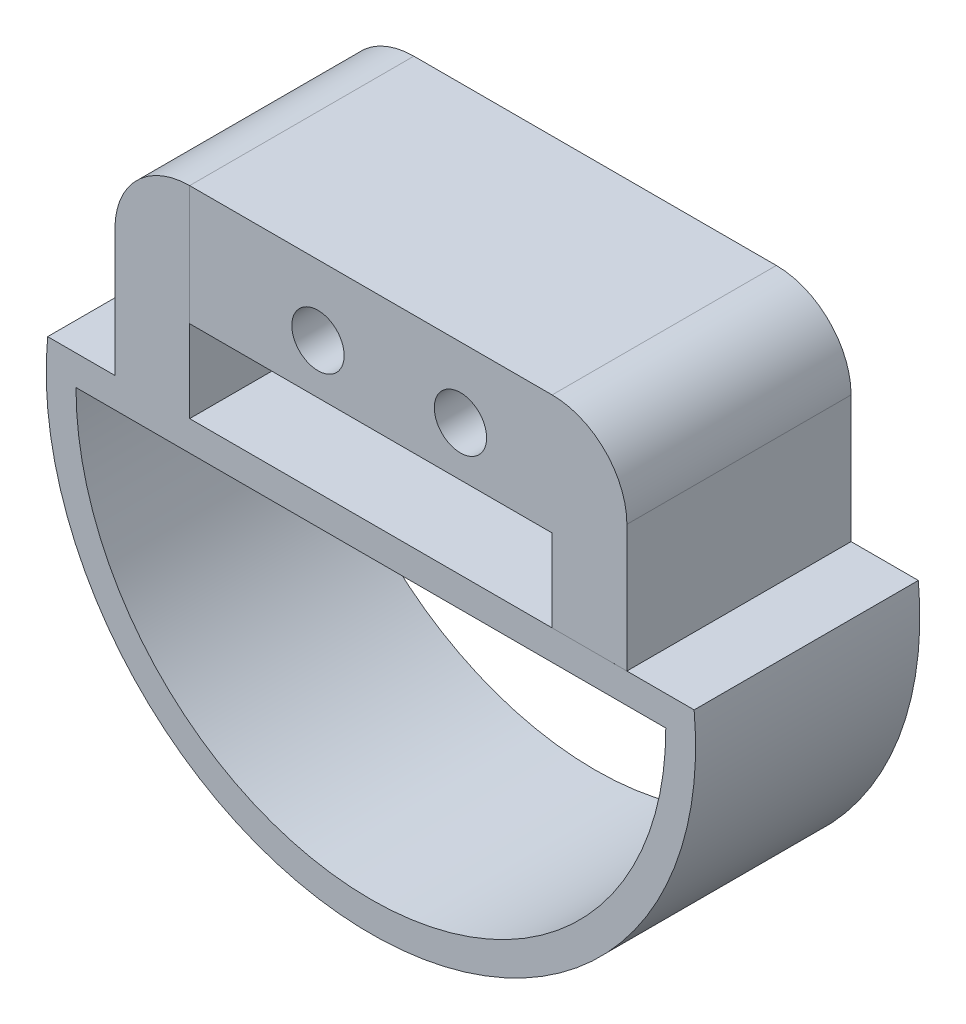
from build123d import *

# Parameters (mm, degrees)
BOSS_EXTRUDE3_DEPTH      = 15
BOSS_EXTRUDE3_DEPTH_BACK = 0.0001
CUT_EXTRUDE13_DEPTH      = 35.189972945
SKETCH31_W               = 5
SKETCH31_H               = 15
BOSS_EXTRUDE4_DEPTH      = 13.5
SKETCH32_W               = 5
SKETCH32_H               = 15.0001
BOSS_EXTRUDE5_DEPTH      = 13.5
BOSS_EXTRUDE6_REACH      = 44.929
SKETCH33_W               = 15
SKETCH33_H               = 8
CUT_EXTRUDE15_REACH      = 36.353
SKETCH34_R               = 1.75
SKETCH34_4_R             = 1.75
CUT_EXTRUDE16_DEPTH      = 15
FILLET1_R                = 5
FILLET2_R                = 5


with BuildPart() as part:
    # Sketch1 → Boss-Extrude3 (new, two sides: drawn at the far end of the back side and taken through both)
    with BuildSketch(Plane.XY.offset(-BOSS_EXTRUDE3_DEPTH_BACK)):
        with BuildLine():
            Line((-21.62638976, 2.067580939), (21.62638976, 2.067580939))
            ThreePointArc((21.62638976, 2.067580939), (0, -21.725), (-21.62638976, 2.067580939))
        make_face()
        with BuildLine():
            Line((18.013033205, -2.860307191), (-18.013033205, -2.860307191))
            ThreePointArc((-18.013033205, -2.860307191), (0, -18.238714935), (18.013033205, -2.860307191))
        make_face(mode=Mode.SUBTRACT)
    extrude(amount=BOSS_EXTRUDE3_DEPTH + BOSS_EXTRUDE3_DEPTH_BACK)

    # Sketch30 → Cut-Extrude13 (cut, through all)
    with BuildSketch(Plane.XY.offset(15)):
        with BuildLine():
            Line((-19.729884258, 0.067580939), (19.729884258, 0.067580939))
            ThreePointArc((19.729884258, 0.067580939), (0, -19.73), (-19.729884258, 0.067580939))
        make_face()
    extrude(amount=-CUT_EXTRUDE13_DEPTH, mode=Mode.SUBTRACT)

    # Sketch31 → Boss-Extrude4 (add)
    with BuildSketch(Plane(origin=(0, 2.067580939, 0), x_dir=(1, 0, 0), z_dir=(0, 1, 0))):
        with Locations((14.62638976, -7.4999)):
            Rectangle(SKETCH31_W, SKETCH31_H)
    extrude(amount=BOSS_EXTRUDE4_DEPTH)

    # Sketch32 → Boss-Extrude5 (add)
    with BuildSketch(Plane(origin=(0, 2.067580939, 0), x_dir=(1, 0, 0), z_dir=(0, 1, 0))):
        with Locations((-14.62638976, -7.49995)):
            Rectangle(SKETCH32_W, SKETCH32_H)
    extrude(amount=BOSS_EXTRUDE5_DEPTH)

    # Sketch33 → Boss-Extrude6 (add, up to next)
    with BuildSketch(Plane.ZY.offset(-12.12638976), mode=Mode.PRIVATE) as boss_extrude6_sk1:
        with Locations((7.4999, 11.567580939)):
            Rectangle(SKETCH33_W, SKETCH33_H)
    boss_extrude6_tool1 = extrude(boss_extrude6_sk1.sketch, amount=BOSS_EXTRUDE6_REACH, mode=Mode.PRIVATE) - part.part
    add(boss_extrude6_tool1.solids().sort_by_distance((12.12639, 11.567581, 7.4999))[0])

    # Sketch34 → Cut-Extrude15 (cut, up to next)
    with BuildSketch(Plane(origin=(0.255092403, 0, -0.0001), x_dir=(-1, 0, 0), z_dir=(0, 0, -1)), mode=Mode.PRIVATE) as cut_extrude15_sk1:
        with Locations((3.7956, 10.885680426)):
            Circle(SKETCH34_R)
    cut_extrude15_tool1 = extrude(cut_extrude15_sk1.sketch, amount=-CUT_EXTRUDE15_REACH, mode=Mode.PRIVATE) & part.part
    add(cut_extrude15_tool1.solids().sort_by_distance((-3.540508, 10.88568, -0.0001))[0], mode=Mode.SUBTRACT)

    # Sketch34<4> → Cut-Extrude16 (cut)
    with BuildSketch(Plane(origin=(0.255092403, 0, -0.0001), x_dir=(-1, 0, 0), z_dir=(0, 0, -1))):
        with Locations((-5.736564211, 10.885680426)):
            Circle(SKETCH34_4_R)
        with Locations((3.7956, 10.885680426)):
            Circle(SKETCH34_4_R)
    extrude(amount=-CUT_EXTRUDE16_DEPTH, mode=Mode.SUBTRACT)

    # Fillet1
    fillet1_edges = [part.edges().sort_by_distance(p)[0] for p in [
        (17.12638976, 15.567580939, 7.4999),
    ]]
    fillet(fillet1_edges, radius=FILLET1_R)

    # Fillet2
    fillet2_edges = [part.edges().sort_by_distance(p)[0] for p in [
        (-17.12638976, 15.567580939, 7.49995),
    ]]
    fillet(fillet2_edges, radius=FILLET2_R)


solid = part.part
